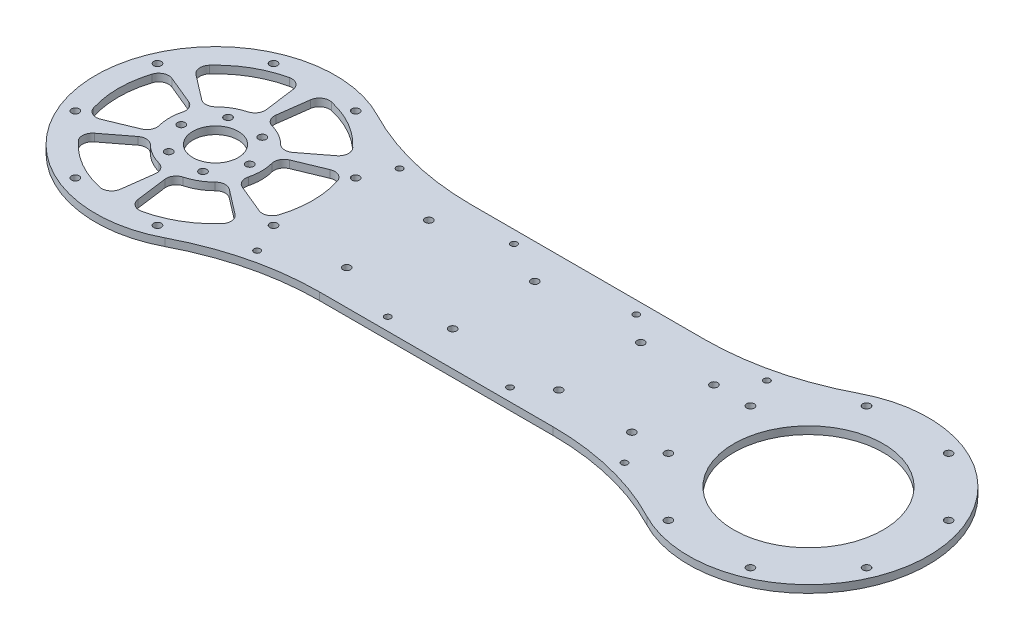
from build123d import *

# Parameters (mm, degrees)
SKETCH_1_R               = 9
SKETCH_1_R_2             = 29.6
SKETCH_1_R_3             = 1.5
EXTRUDE_1_DEPTH          = 3
CUT_EXTRUDE_1_DEPTH      = 287.481238478
CUT_EXTRUDE_1_DEPTH_BACK = 287.481238478
SKETCH_2_R               = 1.25
CUT_EXTRUDE_2_DEPTH      = 287.481238478
CUT_EXTRUDE_2_DEPTH_BACK = 287.481238478
CUT_EXTRUDE_3_DEPTH      = 287.481238478
CUT_EXTRUDE_3_DEPTH_BACK = 287.481238478
SKETCH_4_R               = 1.5


with BuildPart() as part:
    # 草图1 → 凸台-拉伸1 (new body)
    with BuildSketch(Plane(origin=(0, 0, 0), x_dir=(1, 0, 0), z_dir=(0, 1, 0))):
        with BuildLine():
            Line((71.271215686, 30), (163.728784314, 30))
            ThreePointArc((163.728784314, 30), (189.096168452, 33.068787794), (213, 42.09809972))
            ThreePointArc((213, 42.09809972), (282.5, 0), (213, -42.09809972))
            ThreePointArc((213, -42.09809972), (189.096168452, -33.068787794), (163.728784314, -30))
            Line((163.728784314, -30), (71.271215686, -30))
            ThreePointArc((71.271215686, -30), (45.903831548, -33.068787794), (22, -42.09809972))
            ThreePointArc((22, -42.09809972), (-47.5, 0), (22, 42.09809972))
            ThreePointArc((22, 42.09809972), (45.903831548, 33.068787794), (71.271215686, 30))
        make_face()
        with Locations(Location((0, 0, 0), (0, 0, 270))):
            Circle(SKETCH_1_R, mode=Mode.SUBTRACT)
        with Locations(Location((235, 0, 0), (0, 0, 270))):
            Circle(SKETCH_1_R_2, mode=Mode.SUBTRACT)
        with Locations(Location((218.735954124, 39.264880132, 0), (0, 0, 270))):
            Circle(SKETCH_1_R_3, mode=Mode.SUBTRACT)
        with Locations(Location((251.264045876, 39.264880132, 0), (0, 0, 270))):
            Circle(SKETCH_1_R_3, mode=Mode.SUBTRACT)
        with Locations(Location((274.264880132, 16.264045876, 0), (0, 0, 270))):
            Circle(SKETCH_1_R_3, mode=Mode.SUBTRACT)
        with Locations(Location((195.735119868, 16.264045876, 0), (0, 0, 270))):
            Circle(SKETCH_1_R_3, mode=Mode.SUBTRACT)
        with Locations(Location((195.735119868, -16.264045876, 0), (0, 0, 270))):
            Circle(SKETCH_1_R_3, mode=Mode.SUBTRACT)
        with Locations(Location((274.264880132, -16.264045876, 0), (0, 0, 270))):
            Circle(SKETCH_1_R_3, mode=Mode.SUBTRACT)
        with Locations(Location((251.264045876, -39.264880132, 0), (0, 0, 270))):
            Circle(SKETCH_1_R_3, mode=Mode.SUBTRACT)
        with Locations(Location((218.735954124, -39.264880132, 0), (0, 0, 270))):
            Circle(SKETCH_1_R_3, mode=Mode.SUBTRACT)
        with Locations(Location((-16.264045876, 39.264880132, 0), (0, 0, 270))):
            Circle(SKETCH_1_R_3, mode=Mode.SUBTRACT)
        with Locations(Location((16.264045876, 39.264880132, 0), (0, 0, 270))):
            Circle(SKETCH_1_R_3, mode=Mode.SUBTRACT)
        with Locations(Location((39.264880132, 16.264045876, 0), (0, 0, 270))):
            Circle(SKETCH_1_R_3, mode=Mode.SUBTRACT)
        with Locations(Location((39.264880132, -16.264045876, 0), (0, 0, 270))):
            Circle(SKETCH_1_R_3, mode=Mode.SUBTRACT)
        with Locations(Location((16.264045876, -39.264880132, 0), (0, 0, 270))):
            Circle(SKETCH_1_R_3, mode=Mode.SUBTRACT)
        with Locations(Location((-16.264045876, -39.264880132, 0), (0, 0, 270))):
            Circle(SKETCH_1_R_3, mode=Mode.SUBTRACT)
        with Locations(Location((-39.264880132, -16.264045876, 0), (0, 0, 270))):
            Circle(SKETCH_1_R_3, mode=Mode.SUBTRACT)
        with Locations(Location((-39.264880132, 16.264045876, 0), (0, 0, 270))):
            Circle(SKETCH_1_R_3, mode=Mode.SUBTRACT)
        with Locations(Location((-6.783865663, 11.75, 0), (0, 0, 270))):
            Circle(SKETCH_1_R_3, mode=Mode.SUBTRACT)
        with Locations(Location((6.783865663, 11.75, 0), (0, 0, 270))):
            Circle(SKETCH_1_R_3, mode=Mode.SUBTRACT)
        with Locations(Location((13.567731326, 0, 0), (0, 0, 270))):
            Circle(SKETCH_1_R_3, mode=Mode.SUBTRACT)
        with Locations(Location((6.783865663, -11.75, 0), (0, 0, 270))):
            Circle(SKETCH_1_R_3, mode=Mode.SUBTRACT)
        with Locations(Location((-13.567731326, 0, 0), (0, 0, 270))):
            Circle(SKETCH_1_R_3, mode=Mode.SUBTRACT)
        with Locations(Location((-6.783865663, -11.75, 0), (0, 0, 270))):
            Circle(SKETCH_1_R_3, mode=Mode.SUBTRACT)
    extrude(amount=EXTRUDE_1_DEPTH)

    # 草图2 → 切除-拉伸1 (cut, two sides: drawn at the far end of the back side and taken through both)
    with BuildSketch(Plane(origin=(0, 3, 0), x_dir=(1, 0, 0), z_dir=(0, 1, 0)).offset(-CUT_EXTRUDE_1_DEPTH_BACK)):
        with Locations(Location((93.271215686, 25, 0), (0, 0, 270))):
            Circle(SKETCH_2_R)
        with Locations(Location((141.728784314, 25, 0), (0, 0, 270))):
            Circle(SKETCH_2_R)
        with Locations(Location((190.288457303, 28.213023457, 0), (0, 0, 270))):
            Circle(SKETCH_2_R)
        with Locations(Location((44.711542697, 28.213023457, 0), (0, 0, 270))):
            Circle(SKETCH_2_R)
        with Locations(Location((44.711542697, -28.213023457, 0), (0, 0, 270))):
            Circle(SKETCH_2_R)
        with Locations(Location((93.271215686, -25, 0), (0, 0, 270))):
            Circle(SKETCH_2_R)
        with Locations(Location((190.288457303, -28.213023457, 0), (0, 0, 270))):
            Circle(SKETCH_2_R)
        with Locations(Location((141.728784314, -25, 0), (0, 0, 270))):
            Circle(SKETCH_2_R)
    extrude(amount=CUT_EXTRUDE_1_DEPTH + CUT_EXTRUDE_1_DEPTH_BACK, mode=Mode.SUBTRACT)

    # 草图3 → 切除-拉伸2 (cut, two sides: drawn at the far end of the back side and taken through both)
    with BuildSketch(Plane(origin=(0, 3, 0), x_dir=(1, 0, 0), z_dir=(0, 1, 0)).offset(-CUT_EXTRUDE_2_DEPTH_BACK)):
        with BuildLine():
            ThreePointArc((-12.848523388, -12.960630646), (-9.125, -15.804963619), (-4.799973695, -17.607462978))
            ThreePointArc((-4.799973695, -17.607462978), (-2.52132569, -19.251580515), (-1.886243278, -21.988737715))
            Line((-1.886243278, -21.988737715), (-3.494651309, -34.205809627))
            ThreePointArc((-3.494651309, -34.205809627), (-5.165797392, -36.960083611), (-8.325408233, -37.589061943))
            ThreePointArc((-8.325408233, -37.589061943), (-19.25, -33.341978046), (-28.390378431, -26.004545998))
            ThreePointArc((-28.390378431, -26.004545998), (-29.425472637, -22.953753578), (-27.875774439, -20.129361624))
            Line((-27.875774439, -20.129361624), (-18.099683819, -12.627903454))
            ThreePointArc((-18.099683819, -12.627903454), (-15.411694944, -11.809322357), (-12.848523388, -12.960630646))
        make_face()
        with BuildLine():
            ThreePointArc((-17.648497083, 4.646832332), (-18.25, 0), (-17.648497083, -4.646832332))
            ThreePointArc((-17.648497083, -4.646832332), (-17.933020634, -7.442258159), (-19.985927097, -9.360834261))
            Line((-19.985927097, -9.360834261), (-31.370425748, -14.076448003))
            ThreePointArc((-31.370425748, -14.076448003), (-34.591270029, -14.006330033), (-36.715786664, -11.584515945))
            ThreePointArc((-36.715786664, -11.584515945), (-38.5, 0), (-36.715786664, 11.584515945))
            ThreePointArc((-36.715786664, 11.584515945), (-34.591270029, 14.006330033), (-31.370425748, 14.076448003))
            Line((-31.370425748, 14.076448003), (-19.985927097, 9.360834261))
            ThreePointArc((-19.985927097, 9.360834261), (-17.933020634, 7.442258159), (-17.648497083, 4.646832332))
        make_face()
        with BuildLine():
            ThreePointArc((-4.799973695, 17.607462978), (-9.125, 15.804963619), (-12.848523388, 12.960630646))
            ThreePointArc((-12.848523388, 12.960630646), (-15.411694944, 11.809322357), (-18.099683819, 12.627903454))
            Line((-18.099683819, 12.627903454), (-27.875774439, 20.129361624))
            ThreePointArc((-27.875774439, 20.129361624), (-29.425472637, 22.953753578), (-28.390378431, 26.004545998))
            ThreePointArc((-28.390378431, 26.004545998), (-19.25, 33.341978046), (-8.325408233, 37.589061943))
            ThreePointArc((-8.325408233, 37.589061943), (-5.165797392, 36.960083611), (-3.494651309, 34.205809627))
            Line((-3.494651309, 34.205809627), (-1.886243278, 21.988737715))
            ThreePointArc((-1.886243278, 21.988737715), (-2.52132569, 19.251580515), (-4.799973695, 17.607462978))
        make_face()
        with BuildLine():
            ThreePointArc((12.848523388, 12.960630646), (9.125, 15.804963619), (4.799973695, 17.607462978))
            ThreePointArc((4.799973695, 17.607462978), (2.52132569, 19.251580515), (1.886243278, 21.988737715))
            Line((1.886243278, 21.988737715), (3.494651309, 34.205809627))
            ThreePointArc((3.494651309, 34.205809627), (5.165797392, 36.960083611), (8.325408233, 37.589061943))
            ThreePointArc((8.325408233, 37.589061943), (19.25, 33.341978046), (28.390378431, 26.004545998))
            ThreePointArc((28.390378431, 26.004545998), (29.425472637, 22.953753578), (27.875774439, 20.129361624))
            Line((27.875774439, 20.129361624), (18.099683819, 12.627903454))
            ThreePointArc((18.099683819, 12.627903454), (15.411694944, 11.809322357), (12.848523388, 12.960630646))
        make_face()
        with BuildLine():
            ThreePointArc((17.648497083, -4.646832332), (18.25, 0), (17.648497083, 4.646832332))
            ThreePointArc((17.648497083, 4.646832332), (17.933020634, 7.442258159), (19.985927097, 9.360834261))
            Line((19.985927097, 9.360834261), (31.370425748, 14.076448003))
            ThreePointArc((31.370425748, 14.076448003), (34.591270029, 14.006330033), (36.715786664, 11.584515945))
            ThreePointArc((36.715786664, 11.584515945), (38.5, 0), (36.715786664, -11.584515945))
            ThreePointArc((36.715786664, -11.584515945), (34.591270029, -14.006330033), (31.370425748, -14.076448003))
            Line((31.370425748, -14.076448003), (19.985927097, -9.360834261))
            ThreePointArc((19.985927097, -9.360834261), (17.933020634, -7.442258159), (17.648497083, -4.646832332))
        make_face()
        with BuildLine():
            ThreePointArc((4.799973695, -17.607462978), (9.125, -15.804963619), (12.848523388, -12.960630646))
            ThreePointArc((12.848523388, -12.960630646), (15.411694944, -11.809322357), (18.099683819, -12.627903454))
            Line((18.099683819, -12.627903454), (27.875774439, -20.129361624))
            ThreePointArc((27.875774439, -20.129361624), (29.425472637, -22.953753578), (28.390378431, -26.004545998))
            ThreePointArc((28.390378431, -26.004545998), (19.25, -33.341978046), (8.325408233, -37.589061943))
            ThreePointArc((8.325408233, -37.589061943), (5.165797392, -36.960083611), (3.494651309, -34.205809627))
            Line((3.494651309, -34.205809627), (1.886243278, -21.988737715))
            ThreePointArc((1.886243278, -21.988737715), (2.52132569, -19.251580515), (4.799973695, -17.607462978))
        make_face()
    extrude(amount=CUT_EXTRUDE_2_DEPTH + CUT_EXTRUDE_2_DEPTH_BACK, mode=Mode.SUBTRACT)

    # 草图4 → 切除-拉伸3 (cut, two sides: drawn at the far end of the back side and taken through both)
    with BuildSketch(Plane(origin=(0, 3, 0), x_dir=(1, 0, 0), z_dir=(0, 1, 0)).offset(-CUT_EXTRUDE_3_DEPTH_BACK)):
        with Locations(Location((68.264880132, 16.264045876, 0), (0, 0, 270))):
            Circle(SKETCH_4_R)
        with Locations(Location((110.264880132, 16.264045876, 0), (0, 0, 270))):
            Circle(SKETCH_4_R)
        with Locations(Location((152.264880132, 16.264045876, 0), (0, 0, 270))):
            Circle(SKETCH_4_R)
        with Locations(Location((181.264880132, 16.264045876, 0), (0, 0, 270))):
            Circle(SKETCH_4_R)
        with Locations(Location((68.264880132, -16.264045876, 0), (0, 0, 270))):
            Circle(SKETCH_4_R)
        with Locations(Location((110.264880132, -16.264045876, 0), (0, 0, 270))):
            Circle(SKETCH_4_R)
        with Locations(Location((152.264880132, -16.264045876, 0), (0, 0, 270))):
            Circle(SKETCH_4_R)
        with Locations(Location((181.264880132, -16.264045876, 0), (0, 0, 270))):
            Circle(SKETCH_4_R)
    extrude(amount=CUT_EXTRUDE_3_DEPTH + CUT_EXTRUDE_3_DEPTH_BACK, mode=Mode.SUBTRACT)


solid = part.part
